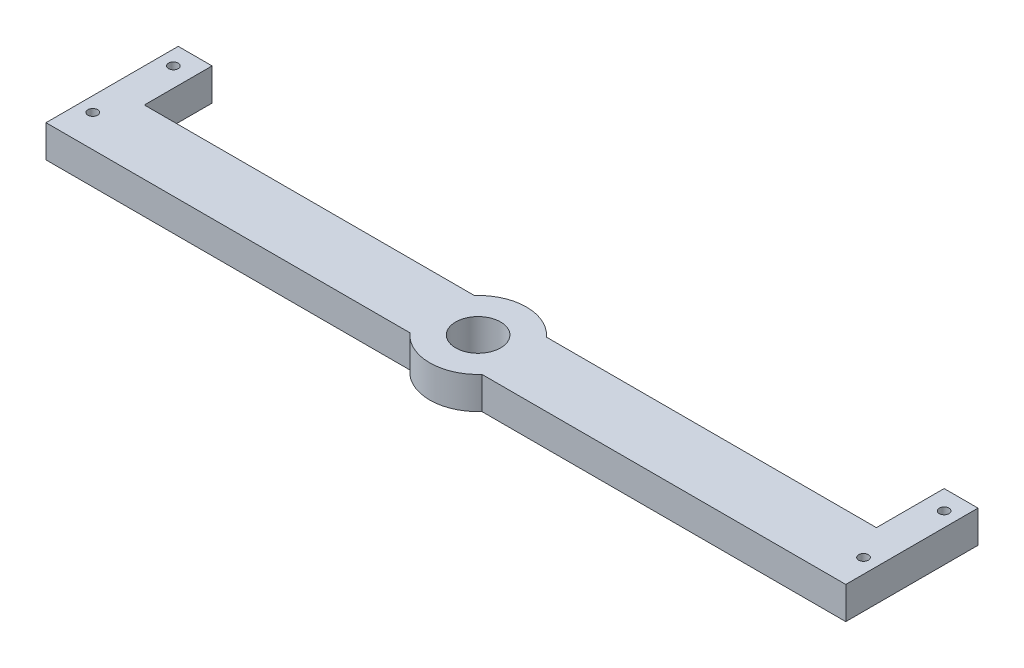
from build123d import *

# Parameters (mm, degrees)
SKETCH1_R           = 1.5
SKETCH1_R_2         = 6.975
BOSS_EXTRUDE1_DEPTH = 10


with BuildPart() as part:
    # Sketch1 → Boss-Extrude1 (new body)
    with BuildSketch(Plane(origin=(0, 0, 0), x_dir=(1, 0, 0), z_dir=(0, 1, 0))):
        with BuildLine():
            Line((-124, -10), (-11.180339887, -10))
            ThreePointArc((-11.180339887, -10), (0, -15), (11.180339887, -10))
            Line((11.180339887, -10), (124, -10))
            Line((124, -10), (124, 10))
            Line((124, 10), (124, 31))
            Line((124, 31), (113.5, 31))
            Line((113.5, 31), (113.5, 10))
            Line((113.5, 10), (11.180339887, 10))
            ThreePointArc((11.180339887, 10), (0, 15), (-11.180339887, 10))
            Line((-11.180339887, 10), (-113.5, 10))
            Line((-113.5, 10), (-113.5, 31))
            Line((-113.5, 31), (-124, 31))
            Line((-124, 31), (-124, 10))
            Line((-124, 10), (-124, -10))
        make_face()
        with Locations(Location((-119.5, 0, 0), (0, 0, 270))):
            Circle(SKETCH1_R, mode=Mode.SUBTRACT)
        with Locations(Location((119.5, 0, 0), (0, 0, 90))):
            Circle(SKETCH1_R, mode=Mode.SUBTRACT)
        with Locations(Location((0, 0, 0), (0, 0, 270))):
            Circle(SKETCH1_R_2, mode=Mode.SUBTRACT)
        with Locations(Location((-119.5, 25, 0), (0, 0, 270))):
            Circle(SKETCH1_R, mode=Mode.SUBTRACT)
        with Locations(Location((119.5, 25, 0), (0, 0, 90))):
            Circle(SKETCH1_R, mode=Mode.SUBTRACT)
    extrude(amount=BOSS_EXTRUDE1_DEPTH)


solid = part.part
